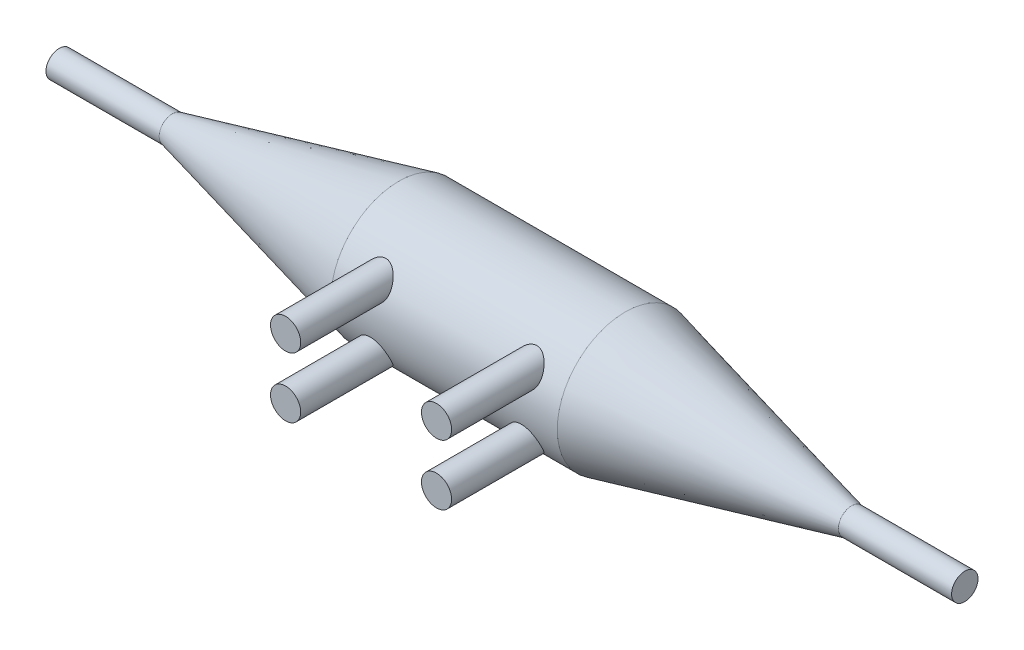
from build123d import *

# Parameters (mm, degrees)
SKETCH2_R           = 2
BOSS_EXTRUDE1_DEPTH = 20


with BuildPart() as part:
    # Sketch1 → Revolve1 (revolve)
    with BuildSketch(Plane.XY):
        Polygon((-16.740830618, 1.75), (-1.740830618, 1.75), (28.259169382, 9), (58.259169382, 9), (88.259169382, 1.75), (103.259169382, 1.75), (103.259169382, 0), (-16.740830618, 0), align=None)
    revolve(axis=Axis((103.259169382, 0, 0), (-1, 0, 0)))

    # Sketch2 → Boss-Extrude1 (add)
    with BuildSketch(Plane.XY):
        with Locations(Location((33.259169382, 4, 0), (0, 0, 180))):
            Circle(SKETCH2_R)
        with Locations(Location((33.259169382, -4, 0), (0, 0, 180))):
            Circle(SKETCH2_R)
        with Locations(Location((53.259169382, 4, 0), (0, 0, 180))):
            Circle(SKETCH2_R)
        with Locations(Location((53.259169382, -4, 0), (0, 0, 180))):
            Circle(SKETCH2_R)
    extrude(amount=BOSS_EXTRUDE1_DEPTH)


solid = part.part
